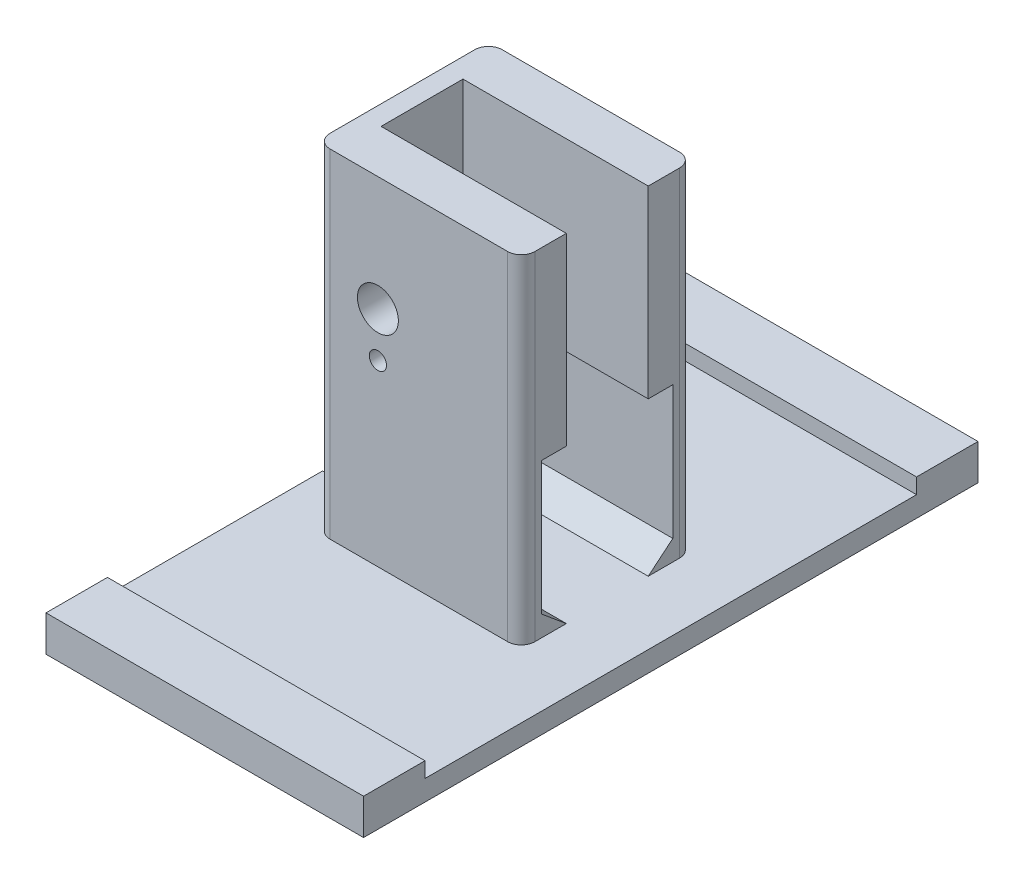
from build123d import *

# Parameters (mm, degrees)
SKETCH2_W             = 39.3827
SKETCH2_H             = 7.62
BOSS_EXTRUDE2_DEPTH   = 4.445
BOSS_EXTRUDE2_2_DEPTH = 4.445
BOSS_EXTRUDE3_DEPTH   = 2.54
BOSS_EXTRUDE4_DEPTH   = 44.45
CUT_EXTRUDE3_REACH    = 78.845
SKETCH5_R             = 2.54
SKETCH5_R_2           = 1.0668
CUT_EXTRUDE5_DEPTH    = 41.91
CUT_EXTRUDE7_START    = 2.54
SKETCH7_W             = 22.974442495
SKETCH7_H             = 3.048
CUT_EXTRUDE7_DEPTH    = 16.51
CUT_EXTRUDE8_DEPTH    = 22.974442495


with BuildPart() as part:
    # Sketch2 → Boss-Extrude2 (new body)
    with BuildSketch(Plane(origin=(0, 0, 0), x_dir=(1, 0, 0), z_dir=(0, 1, 0))):
        with Locations((19.69135, 3.81)):
            Rectangle(SKETCH2_W, SKETCH2_H)
    extrude(amount=BOSS_EXTRUDE2_DEPTH)



with BuildPart() as body_2:
    # Sketch2 → Boss-Extrude2 2 (new body)
    with BuildSketch(Plane(origin=(0, 0, 0), x_dir=(1, 0, 0), z_dir=(0, 1, 0))):
        with Locations((19.69135, 72.39)):
            Rectangle(SKETCH2_W, SKETCH2_H)
    extrude(amount=BOSS_EXTRUDE2_2_DEPTH)


with BuildPart() as part_1:
    add(part.part)

    add(body_2.part)  # Boss-Extrude3 merges body 2
    # Sketch2<3> → Boss-Extrude3 (add)
    with BuildSketch(Plane(origin=(0, 0, 0), x_dir=(1, 0, 0), z_dir=(0, 1, 0))):
        with BuildLine():
            Line((0, 34.29), (0, 7.62))
            Line((0, 7.62), (39.3827, 7.62))
            Line((39.3827, 7.62), (39.3827, 68.58))
            Line((39.3827, 68.58), (0, 68.58))
            Line((0, 68.58), (0, 41.91))
            ThreePointArc((0, 41.91), (3.81, 38.1), (0, 34.29))
        make_face()
    extrude(amount=BOSS_EXTRUDE3_DEPTH)

    # Sketch2<8> → Boss-Extrude4 (add)
    with BuildSketch(Plane(origin=(0, 0, 0), x_dir=(1, 0, 0), z_dir=(0, 1, 0))):
        Polygon((8.533414456, 33.02), (8.533414456, 38.1), (8.533414456, 43.18), (16.153414456, 43.18), (31.507856951, 43.18), (31.507856951, 48.768), (6.107856951, 48.768), (6.107856951, 38.1), (6.107856951, 27.432), (31.507856951, 27.432), (31.507856951, 33.02), (16.153414456, 33.02), align=None)
    extrude(amount=BOSS_EXTRUDE4_DEPTH)

    # Cut-Extrude3: up to this face of the body (flat: up to its plane)
    cut_extrude3_end = Plane(part_1.part.faces().sort_by_distance((18.807856951, 23.495, -27.432))[0])
    # Sketch5 → Cut-Extrude3 (cut, up to the picked face)
    with BuildSketch(Plane(origin=(0, 0, -48.768), x_dir=(-1, 0, 0), z_dir=(0, 0, -1)), mode=Mode.PRIVATE) as cut_extrude3_sk1:
        with Locations((-13.727856951, 30.226)):
            Circle(SKETCH5_R)
    cut_extrude3_tool1 = split(extrude(cut_extrude3_sk1.sketch, amount=-CUT_EXTRUDE3_REACH, mode=Mode.PRIVATE), bisect_by=cut_extrude3_end, keep=Keep.BOTH, mode=Mode.PRIVATE)
    # Sketch5 → Cut-Extrude3 (cut, up to the picked face)
    with BuildSketch(Plane(origin=(0, 0, -48.768), x_dir=(-1, 0, 0), z_dir=(0, 0, -1)), mode=Mode.PRIVATE) as cut_extrude3_sk2:
        with Locations((-13.727856951, 24.6888)):
            Circle(SKETCH5_R_2)
    cut_extrude3_tool2 = split(extrude(cut_extrude3_sk2.sketch, amount=-CUT_EXTRUDE3_REACH, mode=Mode.PRIVATE), bisect_by=cut_extrude3_end, keep=Keep.BOTH, mode=Mode.PRIVATE)
    add(cut_extrude3_tool1.solids().sort_by(Axis((13.727857, 30.226, -48.768), (0, 0, 1)))[0], mode=Mode.SUBTRACT)
    add(cut_extrude3_tool2.solids().sort_by(Axis((13.727857, 24.6888, -48.768), (0, 0, 1)))[0], mode=Mode.SUBTRACT)

    # Sketch6 → Cut-Extrude5 (cut)
    with BuildSketch(Plane(origin=(0, 44.45, 0), x_dir=(1, 0, 0), z_dir=(0, 1, 0))):
        with BuildLine():
            Line((31.507856951, 29.125333333), (31.507856951, 27.432))
            Line((31.507856951, 27.432), (29.814523617, 27.432))
            ThreePointArc((29.814523617, 27.432), (31.0118911, 27.927965851), (31.507856951, 29.125333333))
        make_face()
        with BuildLine():
            Line((7.801190284, 48.768), (6.107856951, 48.768))
            Line((6.107856951, 48.768), (6.107856951, 47.074666667))
            ThreePointArc((6.107856951, 47.074666667), (6.603822801, 48.272034149), (7.801190284, 48.768))
        make_face()
        with BuildLine():
            Line((6.107856951, 29.125333333), (6.107856951, 27.432))
            Line((6.107856951, 27.432), (7.801190284, 27.432))
            ThreePointArc((7.801190284, 27.432), (6.603822801, 27.927965851), (6.107856951, 29.125333333))
        make_face()
        with BuildLine():
            Line((29.814523617, 48.768), (31.507856951, 48.768))
            Line((31.507856951, 48.768), (31.507856951, 47.074666667))
            ThreePointArc((31.507856951, 47.074666667), (31.0118911, 48.272034149), (29.814523617, 48.768))
        make_face()
    extrude(amount=-CUT_EXTRUDE5_DEPTH, mode=Mode.SUBTRACT)

    # Sketch7 → Cut-Extrude7 (cut)
    with BuildSketch(Plane(origin=(0, 2.54, 0), x_dir=(1, 0, 0), z_dir=(0, 1, 0)).offset(CUT_EXTRUDE7_START)):
        with Locations((20.020635704, 44.704)):
            Rectangle(SKETCH7_W, SKETCH7_H)
        with Locations((20.020635704, 31.496)):
            Rectangle(SKETCH7_W, SKETCH7_H)
    extrude(amount=CUT_EXTRUDE7_DEPTH, mode=Mode.SUBTRACT)

    # Sketch8 → Cut-Extrude8 (cut)
    with BuildSketch(Plane(origin=(31.507856951, 0, 0), x_dir=(0, 0, -1), z_dir=(1, 0, 0))):
        Polygon((33.02, 2.54), (29.972, 5.08), (33.02, 5.08), align=None)
        Polygon((43.18, 2.54), (46.228, 5.08), (43.18, 5.08), align=None)
    extrude(amount=-CUT_EXTRUDE8_DEPTH, mode=Mode.SUBTRACT)


solid = part_1.part
